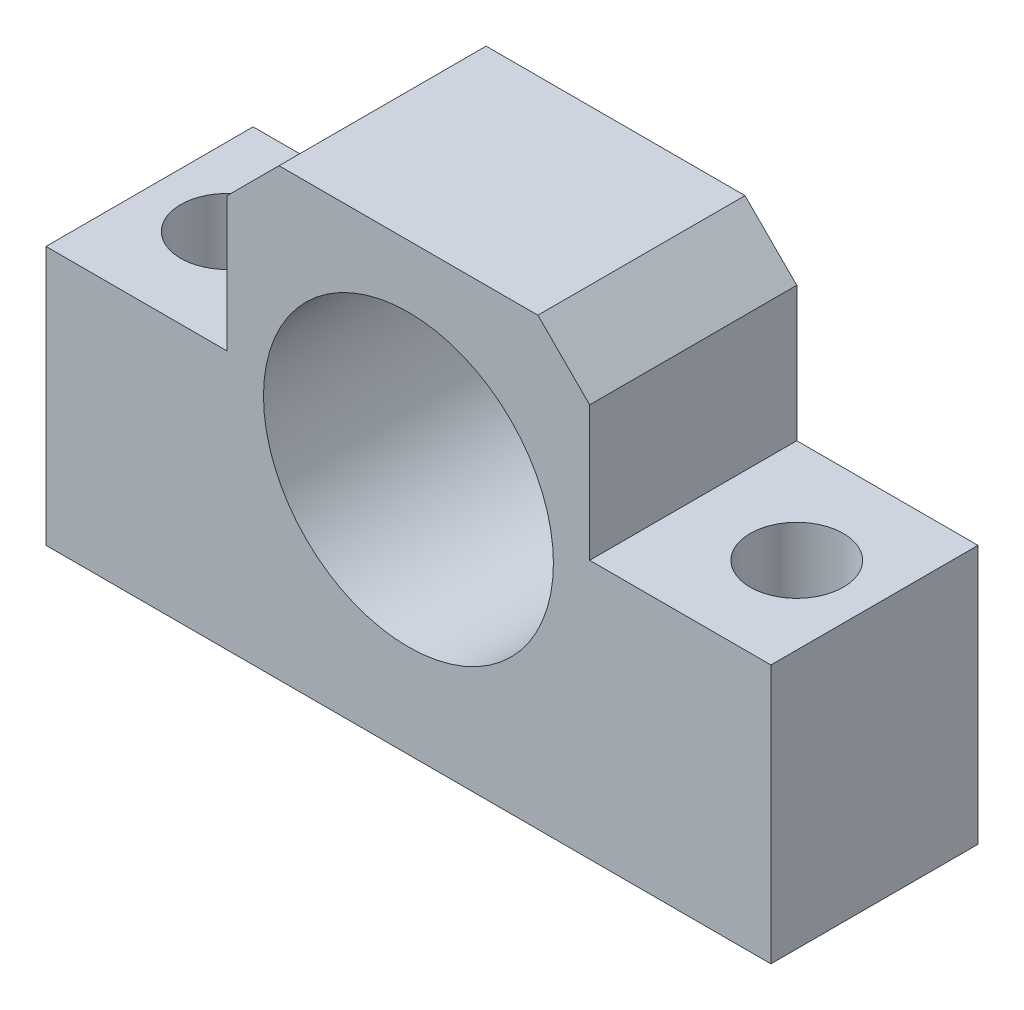
from build123d import *
from build123d.topology import SkipClean

# Parameters (mm, degrees)
SKETCH_1_W                    = 70
SKETCH_1_H                    = 43
EXTRUDE_1_DEPTH               = 20
SKETCH_2_W                    = 17.5
SKETCH_2_H                    = 18
CUT_EXTRUDE_1_DEPTH           = 51.549480709
SKETCH_3_W                    = 17.5
SKETCH_3_H                    = 18
CUT_EXTRUDE_2_DEPTH           = 51.549480709
HOLE_WIZARD_9_0_9_1_D         = 9
HOLE_WIZARD_9_0_9_2_D         = 9
HOLE_WIZARD_9_0_9_2_DEPTH     = 43
HOLE_WIZARD_M24_1_D           = 25
HOLE_WIZARD_M24_1_CBORE_D     = 32
HOLE_WIZARD_M24_1_CBORE_DEPTH = 12
CHAMFER_1_SIZE                = 5
EXTRUDE_START                 = 12
SKETCH_15_R                   = 16
SKETCH_15_R_2                 = 14
EXTRUDE_3_DEPTH               = 12
CUT_EXTRUDE_START             = -10
SKETCH_16_R                   = 14
CUT_EXTRUDE_7_DEPTH           = 10


with BuildPart() as part:
    # 草图1 → 凸台-拉伸1 (new body)
    with BuildSketch(Plane.XY.offset(20)):
        with Locations((0, 9)):
            Rectangle(SKETCH_1_W, SKETCH_1_H)
    extrude(amount=-EXTRUDE_1_DEPTH)

    # 草图2 → 切除-拉伸1 (cut, through all)
    with BuildSketch(Plane(origin=(0, 0, 0), x_dir=(-1, 0, 0), z_dir=(0, 0, -1))):
        with Locations((26.25, 21.5)):
            Rectangle(SKETCH_2_W, SKETCH_2_H)
    extrude(amount=-CUT_EXTRUDE_1_DEPTH, mode=Mode.SUBTRACT)

    # 草图3 → 切除-拉伸2 (cut, through all)
    with BuildSketch(Plane(origin=(0, 0, 0), x_dir=(-1, 0, 0), z_dir=(0, 0, -1))):
        with Locations((-26.25, 21.5)):
            Rectangle(SKETCH_3_W, SKETCH_3_H)
    extrude(amount=-CUT_EXTRUDE_2_DEPTH, mode=Mode.SUBTRACT)

    # Ø9.0 (9) 直径孔1 (through all)
    with Locations(Plane(origin=(0, 12.5, 0), x_dir=(1, 0, 0), z_dir=(0, 1, 0))):
        with Locations((27.5, -10)):
            Hole(HOLE_WIZARD_9_0_9_1_D / 2)

    # Ø9.0 (9) 直径孔2
    with Locations(Plane(origin=(0, -12.5, 0), x_dir=(-1, 0, 0), z_dir=(0, -1, 0))):
        with Locations((27.5, -10)):
            Hole(HOLE_WIZARD_9_0_9_2_D / 2, depth=HOLE_WIZARD_9_0_9_2_DEPTH)

    # M24 六角头螺栓的柱形沉头孔1 (through all)
    with Locations(Plane.XY.offset(20)):
        with Locations((0, 10.5)):
            CounterBoreHole(HOLE_WIZARD_M24_1_D / 2, HOLE_WIZARD_M24_1_CBORE_D / 2, HOLE_WIZARD_M24_1_CBORE_DEPTH)

    # 倒角1
    chamfer_1_edges = [part.edges().sort_by_distance(p)[0] for p in [
        (-17.5, 30.5, 10),
        (17.5, 30.5, 10),
    ]]
    chamfer(chamfer_1_edges, length=CHAMFER_1_SIZE)

    # 草图15 → 凸台-拉伸3 (add)
    with BuildSketch(Plane.XY.offset(8).offset(EXTRUDE_START)):
        with Locations((0, 10.5)):
            Circle(SKETCH_15_R)
        with Locations((0, 10.5)):
            Circle(SKETCH_15_R_2, mode=Mode.SUBTRACT)
    extrude(amount=-EXTRUDE_3_DEPTH)

    # 草图16 → 切除-拉伸7 (cut)
    with SkipClean():  # the faces are left unmerged after this step: merging them gives an invalid solid
        with BuildSketch(Plane(origin=(0, 0, 0), x_dir=(-1, 0, 0), z_dir=(0, 0, -1)).offset(CUT_EXTRUDE_START)):
            with Locations((0, 10.5)):
                Circle(SKETCH_16_R)
        extrude(amount=CUT_EXTRUDE_7_DEPTH, mode=Mode.SUBTRACT)


solid = part.part
